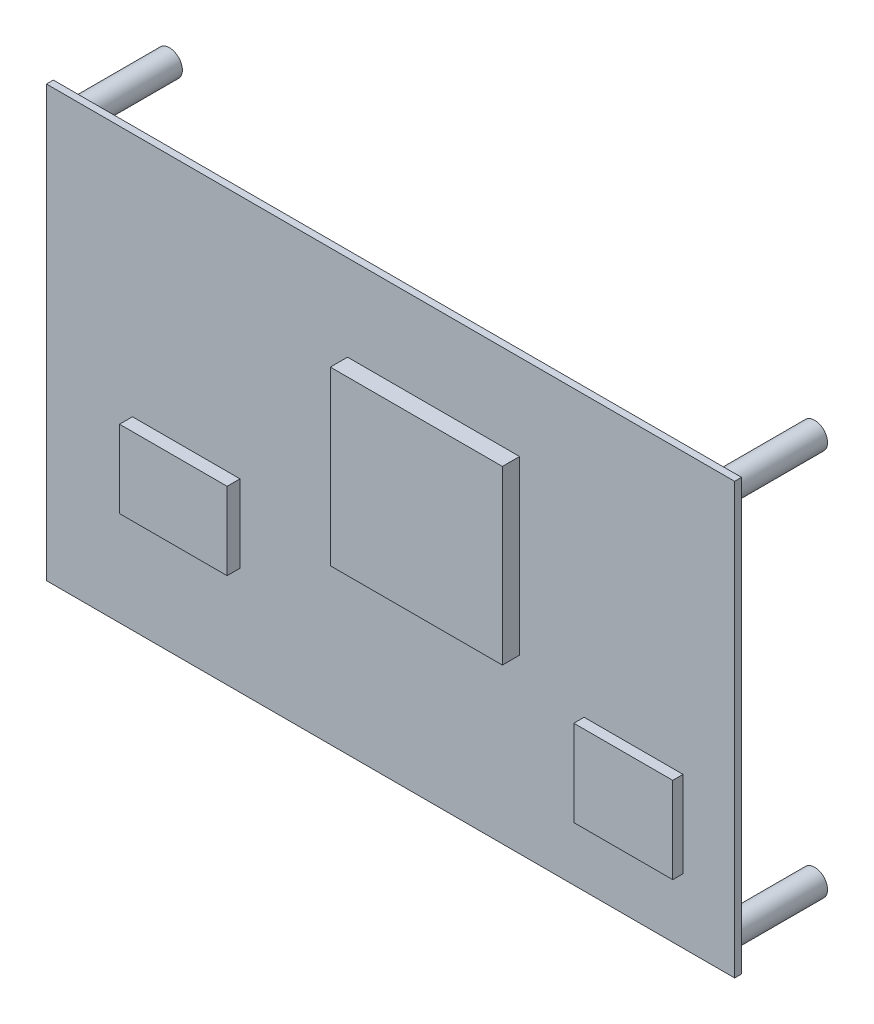
from build123d import *

# Parameters (mm, degrees)
EXTRUDE_START      = 345
EXTRUDE_SKETCH_1_W = 160
EXTRUDE_SKETCH_1_H = 100
EXTRUDE_1_DEPTH    = 1.6
EXTRUDE_START_2    = 346.6
EXTRUDE_SKETCH_2_W = 25
EXTRUDE_SKETCH_2_H = 18
EXTRUDE_2_DEPTH    = 3
EXTRUDE_SKETCH_3_W = 40
EXTRUDE_SKETCH_3_H = 40
EXTRUDE_3_DEPTH    = 4
EXTRUDE_SKETCH_4_W = 23
EXTRUDE_SKETCH_4_H = 20
EXTRUDE_4_DEPTH    = 2.4
EXTRUDE_START_3    = 323
EXTRUDE_SKETCH_5_R = 3
EXTRUDE_5_DEPTH    = 22
EXTRUDE_SKETCH_6_R = 3
EXTRUDE_6_DEPTH    = 22
EXTRUDE_SKETCH_7_R = 3
EXTRUDE_7_DEPTH    = 22
EXTRUDE_SKETCH_8_R = 3
EXTRUDE_8_DEPTH    = 22


with BuildPart() as part:
    # Extrude sketch 1 → Extrude 1 (new body)
    with BuildSketch(Plane.XY.offset(EXTRUDE_START)):
        with Locations((557, 55)):
            Rectangle(EXTRUDE_SKETCH_1_W, EXTRUDE_SKETCH_1_H)
    extrude(amount=EXTRUDE_1_DEPTH)


with BuildPart() as body_2:
    # Extrude sketch 2 → Extrude 2 (new body)
    with BuildSketch(Plane.XY.offset(EXTRUDE_START_2)):
        with Locations((509.5, 39)):
            Rectangle(EXTRUDE_SKETCH_2_W, EXTRUDE_SKETCH_2_H)
    extrude(amount=EXTRUDE_2_DEPTH)


with BuildPart() as body_3:
    # Extrude sketch 3 → Extrude 3 (new body)
    with BuildSketch(Plane.XY.offset(EXTRUDE_START_2)):
        with Locations((567, 65)):
            Rectangle(EXTRUDE_SKETCH_3_W, EXTRUDE_SKETCH_3_H)
    extrude(amount=EXTRUDE_3_DEPTH)


with BuildPart() as body_4:
    # Extrude sketch 4 → Extrude 4 (new body)
    with BuildSketch(Plane.XY.offset(EXTRUDE_START_2)):
        with Locations((613.5, 30)):
            Rectangle(EXTRUDE_SKETCH_4_W, EXTRUDE_SKETCH_4_H)
    extrude(amount=EXTRUDE_4_DEPTH)


with BuildPart() as body_5:
    # Extrude sketch 5 → Extrude 5 (new body)
    with BuildSketch(Plane.XY.offset(EXTRUDE_START_3)):
        with Locations((482, 10)):
            Circle(EXTRUDE_SKETCH_5_R)
    extrude(amount=EXTRUDE_5_DEPTH)


with BuildPart() as body_6:
    # Extrude sketch 6 → Extrude 6 (new body)
    with BuildSketch(Plane.XY.offset(EXTRUDE_START_3)):
        with Locations((482, 100)):
            Circle(EXTRUDE_SKETCH_6_R)
    extrude(amount=EXTRUDE_6_DEPTH)


with BuildPart() as body_7:
    # Extrude sketch 7 → Extrude 7 (new body)
    with BuildSketch(Plane.XY.offset(EXTRUDE_START_3)):
        with Locations((632, 10)):
            Circle(EXTRUDE_SKETCH_7_R)
    extrude(amount=EXTRUDE_7_DEPTH)


with BuildPart() as body_8:
    # Extrude sketch 8 → Extrude 8 (new body)
    with BuildSketch(Plane.XY.offset(EXTRUDE_START_3)):
        with Locations((632, 100)):
            Circle(EXTRUDE_SKETCH_8_R)
    extrude(amount=EXTRUDE_8_DEPTH)


with BuildPart() as body_5_1:
    add(body_5.part)

    # Combine (weld / assembly of features): union body 3, body 6, part, body 7, body 2, body 8, body 4
    add(body_3.part)
    add(body_6.part)
    add(part.part)
    add(body_7.part)
    add(body_2.part)
    add(body_8.part)
    add(body_4.part)


solid = body_5_1.part
